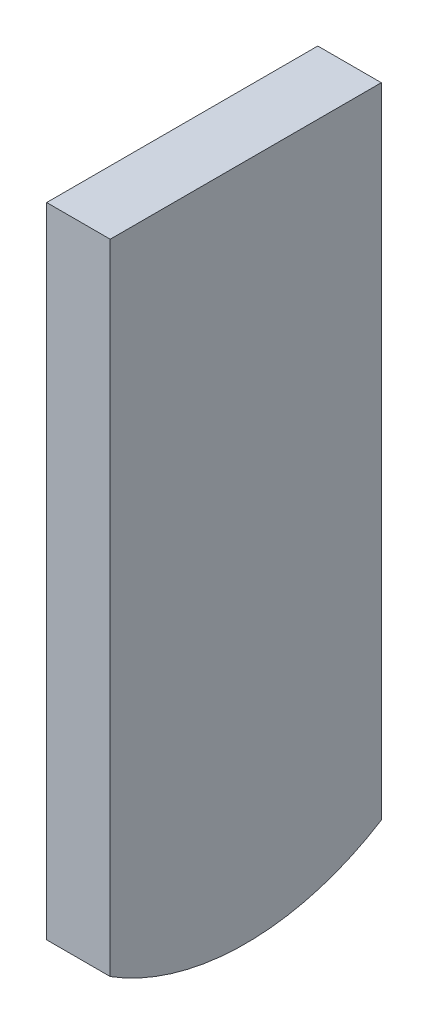
from build123d import *

# Parameters (mm, degrees)
SPIN_W           = 1.5
SPIN_H           = 6.4
FPIN_DEPTH       = 16
FPIN2_DEPTH      = 17.334090119
FPIN2_DEPTH_BACK = 17.334090119


with BuildPart() as part:
    # SPin → FPin (new body)
    with BuildSketch(Plane(origin=(0, 0, 0), x_dir=(1, 0, 0), z_dir=(0, 1, 0))):
        Rectangle(SPIN_W, SPIN_H)
    extrude(amount=-FPIN_DEPTH)

    # SPin2 → FPin2 (cut, two sides: drawn at the far end of the back side and taken through both)
    with BuildSketch(Plane(origin=(0, 0, 0), x_dir=(0, 0, -1), z_dir=(1, 0, 0)).offset(-FPIN2_DEPTH_BACK)):
        with BuildLine():
            Line((-39.366991309, 7.727434754), (-3.2, -15.075431016))
            ThreePointArc((-3.2, -15.075431016), (0, -16), (3.2, -15.075431016))
            Line((3.2, -15.075431016), (39.366991309, 7.727434754))
            Line((39.366991309, 7.727434754), (39.366991309, -77.783311885))
            Line((39.366991309, -77.783311885), (-39.366991309, -77.783311885))
            Line((-39.366991309, -77.783311885), (-39.366991309, 7.727434754))
        make_face()
    extrude(amount=FPIN2_DEPTH + FPIN2_DEPTH_BACK, mode=Mode.SUBTRACT)


solid = part.part
